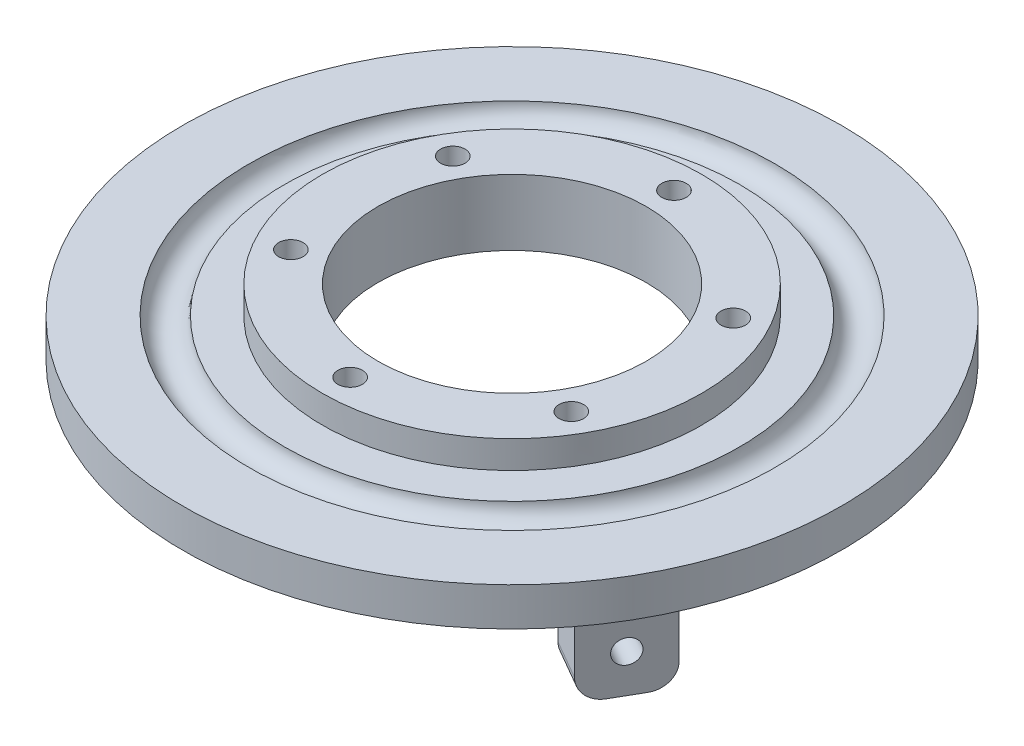
from build123d import *

# Parameters (mm, degrees)
SKETCH2_R                = 24.75
BOSS_EXTRUDE1_DEPTH      = 3.6
CUT_EXTRUDE1_DEPTH       = 62.416284485
CUT_EXTRUDE1_DEPTH_BACK  = 62.416284485
SKETCH3_R                = 17.5
CUT_EXTRUDE2_DEPTH       = 62.416284485
CUT_EXTRUDE2_DEPTH_BACK  = 62.416284485
SKETCH4_R                = 1.6
SKETCH5_W                = 10
SKETCH5_H                = 5.9
BOSS_EXTRUDE2_DEPTH      = 10
FILLET1_R                = 3
SKETCH6_R                = 1.55
CUT_EXTRUDE3_DEPTH       = 62.627915753
CIRPATTERN1_COUNT        = 3
FILLET1_OF_CIRPATTERN1_R = 3


with BuildPart() as part:
    # Sketch1 → Revolve1 (revolve)
    with BuildSketch(Plane.XY, mode=Mode.PRIVATE) as revolve1_sk:
        with BuildLine():
            Line((-34.322848467, 5), (-43, 5))
            Line((-43, 5), (-43, 0))
            Line((-43, 0), (0, 0))
            Line((0, 0), (0, 5))
            Line((0, 5), (-29.677151533, 5))
            ThreePointArc((-29.677151533, 5), (-32, 2.775), (-34.322848467, 5))
        make_face()
    revolve(revolve1_sk.sketch.rotate(Axis((0, 0, 0), (0, 1, 0)), 270), axis=Axis((0, 0, 0), (0, 1, 0)))

    # Sketch2 → Boss-Extrude1 (add)
    with BuildSketch(Plane(origin=(0, 5, 0), x_dir=(1, 0, 0), z_dir=(0, 1, 0))):
        with Locations(Location((0, 0, 0), (0, 0, 90))):
            Circle(SKETCH2_R)
    extrude(amount=BOSS_EXTRUDE1_DEPTH)

    # Sketch3 → Cut-Extrude1 (cut, two sides: drawn at the far end of the back side and taken through both)
    with BuildSketch(Plane(origin=(0, 8.6, 0), x_dir=(1, 0, 0), z_dir=(0, 1, 0)).offset(-CUT_EXTRUDE1_DEPTH_BACK)):
        with Locations(Location((0, 0, 0), (0, 0, 270))):
            Circle(SKETCH3_R)
    extrude(amount=CUT_EXTRUDE1_DEPTH + CUT_EXTRUDE1_DEPTH_BACK, mode=Mode.SUBTRACT)

    # Sketch4 → Cut-Extrude2 (cut, two sides: drawn at the far end of the back side and taken through both)
    with BuildSketch(Plane(origin=(0, 8.6, 0), x_dir=(1, 0, 0), z_dir=(0, 1, 0)).offset(-CUT_EXTRUDE2_DEPTH_BACK)):
        with Locations(Location((0, 21.125, 0), (0, 0, 270))):
            Circle(SKETCH4_R)
        with Locations(Location((18.294786655, 10.5625, 0), (0, 0, 270))):
            Circle(SKETCH4_R)
        with Locations(Location((18.294786655, -10.5625, 0), (0, 0, 270))):
            Circle(SKETCH4_R)
        with Locations(Location((0, -21.125, 0), (0, 0, 270))):
            Circle(SKETCH4_R)
        with Locations(Location((-18.294786655, -10.5625, 0), (0, 0, 270))):
            Circle(SKETCH4_R)
        with Locations(Location((-18.294786655, 10.5625, 0), (0, 0, 270))):
            Circle(SKETCH4_R)
    extrude(amount=CUT_EXTRUDE2_DEPTH + CUT_EXTRUDE2_DEPTH_BACK, mode=Mode.SUBTRACT)

    # Sketch5 → Boss-Extrude2 (add)
    with BuildSketch(Plane(origin=(0, 0, 0), x_dir=(1, 0, 0), z_dir=(0, 1, 0))):
        with Locations((0, 37.95)):
            Rectangle(SKETCH5_W, SKETCH5_H)
    boss_extrude2 = extrude(amount=-BOSS_EXTRUDE2_DEPTH)

    # Fillet1
    fillet1_edges = [part.edges().sort_by_distance(p)[0] for p in [
        (-5, -10, -37.95),
        (5, -10, -37.95),
    ]]
    fillet(fillet1_edges, radius=FILLET1_R)

    # Sketch6 → Cut-Extrude3 (cut, symmetric)
    with BuildSketch(Plane.XY):
        with Locations((0, -5)):
            Circle(SKETCH6_R)
    cut_extrude3 = extrude(amount=CUT_EXTRUDE3_DEPTH, both=True, mode=Mode.SUBTRACT)

    # CirPattern1: Boss-Extrude2, Cut-Extrude3 ×3 about axis
    cirpattern1_axis = Axis((0, 0, 0), (0, 1, 0))
    add([boss_extrude2.rotate(cirpattern1_axis, i * 360 / CIRPATTERN1_COUNT) for i in range(1, CIRPATTERN1_COUNT)])
    add([cut_extrude3.rotate(cirpattern1_axis, i * 360 / CIRPATTERN1_COUNT) for i in range(1, CIRPATTERN1_COUNT)], mode=Mode.SUBTRACT)

    # Fillet1 of CirPattern1
    fillet1_of_cirpattern1_edges = [part.edges().sort_by_distance(p)[0] for p in [
        (-30.365664074, -10, 23.305127019),
        (-35.365664074, -10, 14.644872981),
        (35.365664074, -10, 14.644872981),
        (30.365664074, -10, 23.305127019),
    ]]
    fillet(fillet1_of_cirpattern1_edges, radius=FILLET1_OF_CIRPATTERN1_R)


solid = part.part
